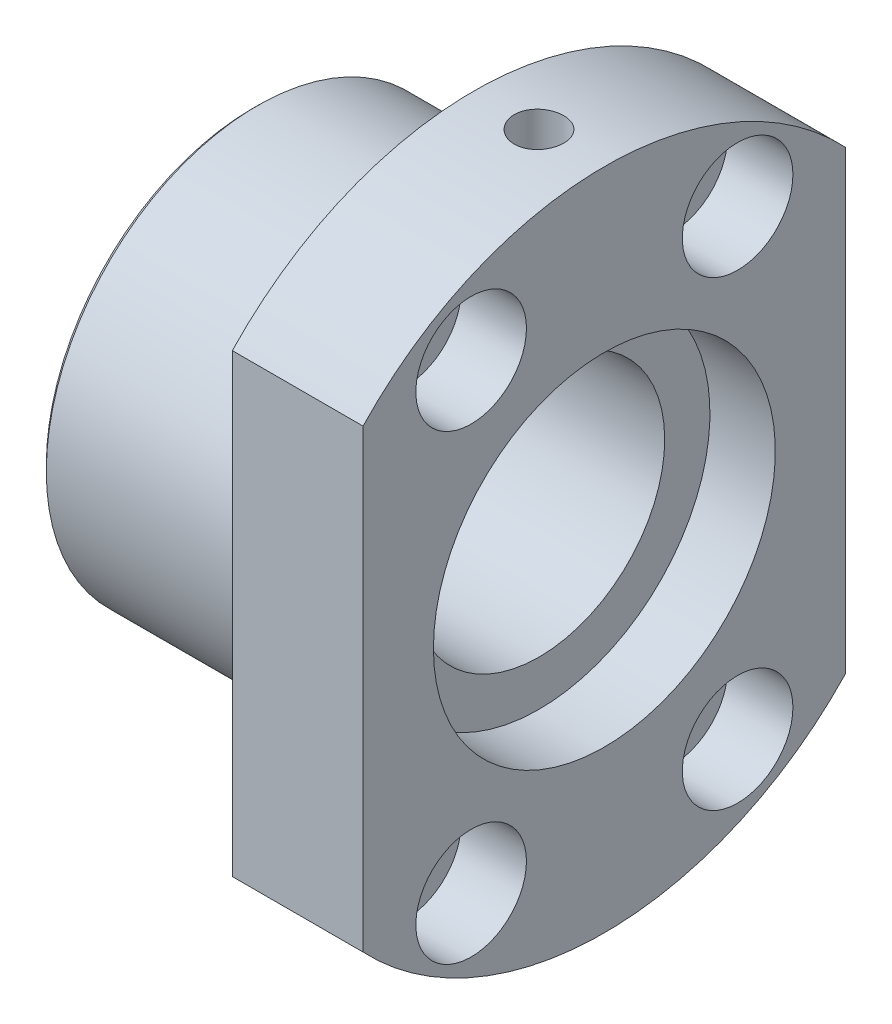
from build123d import *

# Parameters (mm, degrees)
CUT_EXTRUDE1_DEPTH                 = 52.594573358
SOCKET_HEAD_CAP_SCREW1_D           = 6.6
SOCKET_HEAD_CAP_SCREW1_CBORE_D     = 11
SOCKET_HEAD_CAP_SCREW1_CBORE_DEPTH = 6.5
TAP1_D                             = 4.917
TAP1_DEPTH                         = 32.999
TAP1_TIP                           = 1.477215832
CHAMFER1_SIZE                      = 0.5


with BuildPart() as part:
    # Sketch1 → Revolve1 (revolve)
    with BuildSketch(Plane.XY, mode=Mode.PRIVATE) as revolve1_sk:
        Polygon((6.5, 17), (6.5, 12.5), (-17, 12.5), (-17, 17), (-22, 17), (-22, 21), (0, 21), (0, 33), (13, 33), (13, 17), align=None)
    revolve(revolve1_sk.sketch.rotate(Axis((-22, 0, 0), (1, 0, 0)), 90), axis=Axis((-22, 0, 0), (1, 0, 0)))

    # Sketch2 → Cut-Extrude1 (cut, through all)
    with BuildSketch(Plane(origin=(0, 0, 0), x_dir=(0, 0, -1), z_dir=(1, 0, 0))):
        with BuildLine():
            Line((24, 22.649503306), (24, -22.649503306))
            ThreePointArc((24, -22.649503306), (33, 0), (24, 22.649503306))
        make_face()
        with BuildLine():
            Line((-24, 22.649503306), (-24, -22.649503306))
            ThreePointArc((-24, -22.649503306), (-33, 0), (-24, 22.649503306))
        make_face()
    extrude(amount=CUT_EXTRUDE1_DEPTH, mode=Mode.SUBTRACT)

    # Socket Head Cap Screw1 (through all)
    with Locations(Plane(origin=(13, 0, 0), x_dir=(0, 0, -1), z_dir=(1, 0, 0))):
        with Locations((-13.25, 22.9496732), (13.25, -22.9496732), (-13.25, -22.9496732), (13.25, 22.9496732)):
            CounterBoreHole(SOCKET_HEAD_CAP_SCREW1_D / 2, SOCKET_HEAD_CAP_SCREW1_CBORE_D / 2, SOCKET_HEAD_CAP_SCREW1_CBORE_DEPTH)

    # Tap1
    with Locations(Plane(origin=(0, 33, 0), x_dir=(1, 0, 0), z_dir=(0, 1, 0))):
        with Locations((6.5, 0)):
            Hole(TAP1_D / 2, depth=TAP1_DEPTH)
            with Locations((0, 0, -(TAP1_DEPTH + TAP1_TIP / 2))):  # 118° drill point
                Cone(0, TAP1_D / 2, TAP1_TIP, mode=Mode.SUBTRACT)

    # Chamfer1
    chamfer1_edges = [part.edges().sort_by_distance(p)[0] for p in [
        (-22, 0, -21),
    ]]
    chamfer(chamfer1_edges, length=CHAMFER1_SIZE)


solid = part.part
